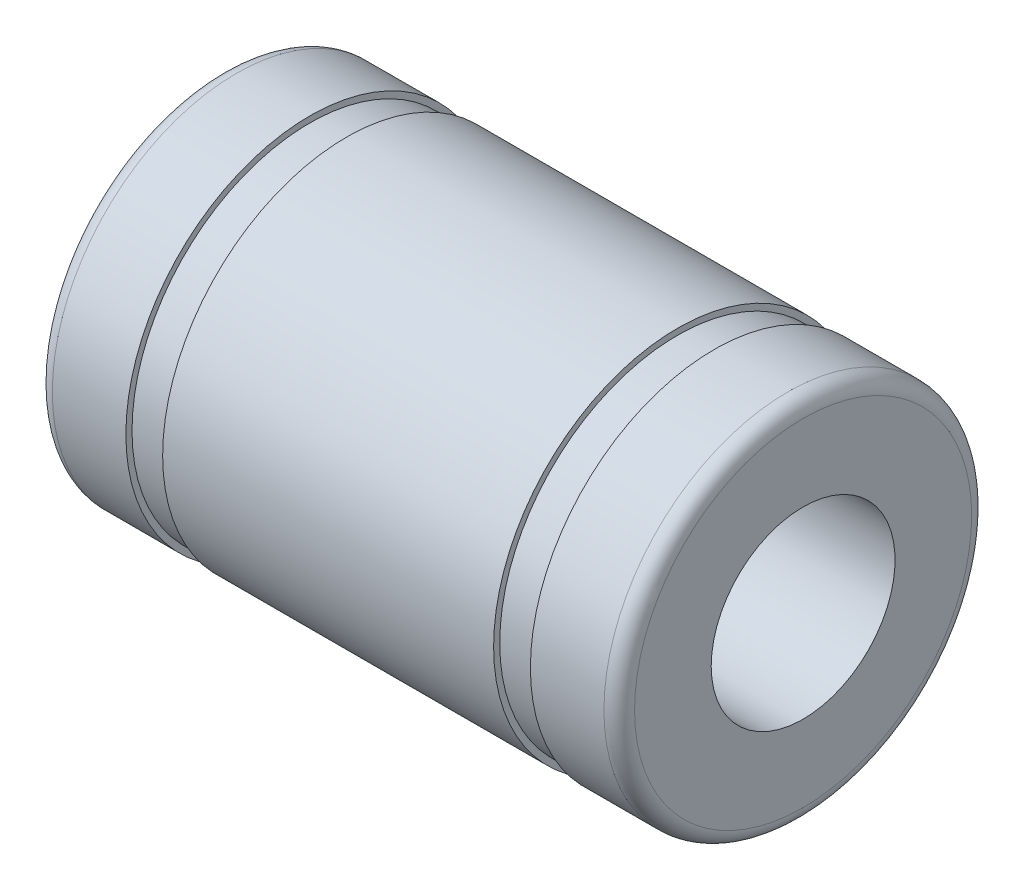
from build123d import *

# Parameters (mm, degrees)
FILLET1_R = 0.5


with BuildPart() as part:
    # Sketch2 → Revolve1 (revolve)
    with BuildSketch(Plane(origin=(0, 0, 0), x_dir=(1, 0, 0), z_dir=(0, 1, 0)), mode=Mode.PRIVATE) as revolve1_sk:
        Polygon((-5.4, 6), (5.4, 6), (5.4, 5.8), (6.6, 5.8), (6.6, 6), (9.5, 6), (9.5, 3), (-9.5, 3), (-9.5, 6), (-6.6, 6), (-6.6, 5.8), (-5.4, 5.8), align=None)
    revolve(revolve1_sk.sketch.rotate(Axis((0, 0, 0), (1, 0, 0)), 180), axis=Axis((0, 0, 0), (1, 0, 0)))

    # Fillet1
    fillet1_edges = [part.edges().sort_by_distance(p)[0] for p in [
        (-9.5, 0, -6),
        (9.5, 0, -6),
    ]]
    fillet(fillet1_edges, radius=FILLET1_R)


solid = part.part
